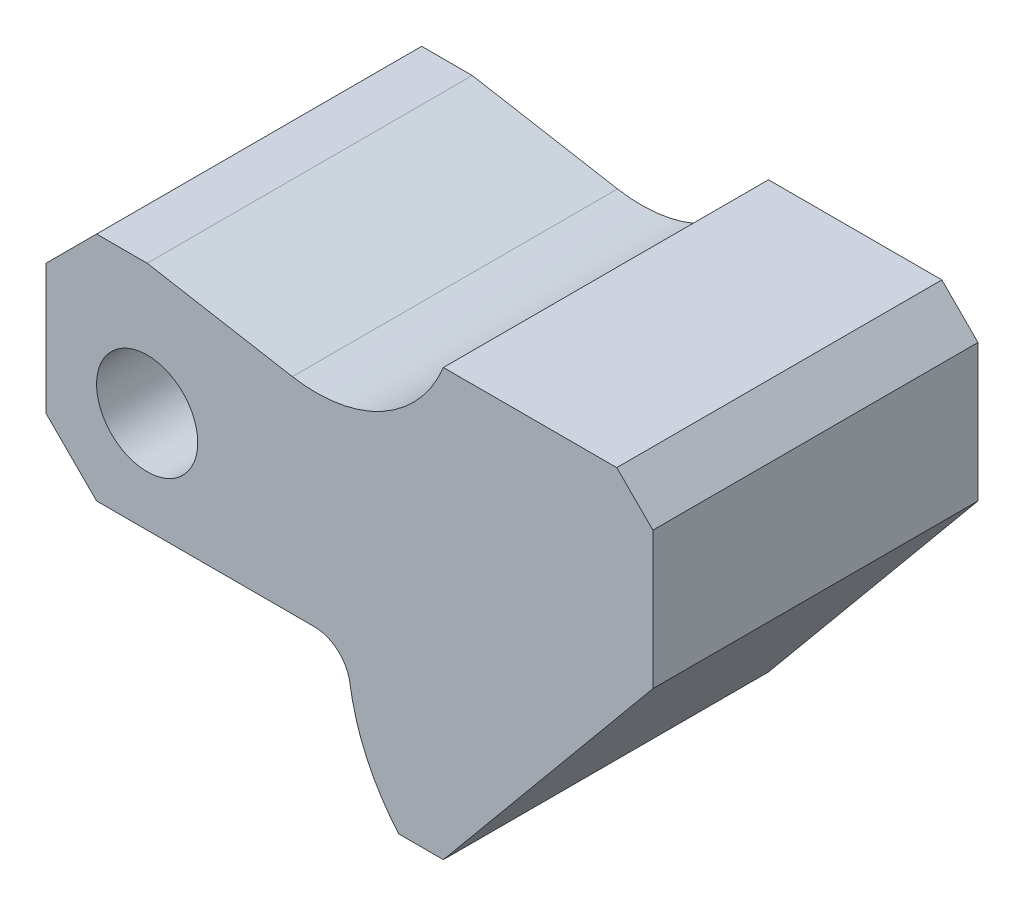
from build123d import *

# Parameters (mm, degrees)
BOSS_EXTRU_1_DEPTH      = 22.5
ESQUISSE2_R             = 7
ENL_V_MAT_EXTRU_1_DEPTH = 89.82992258


with BuildPart() as part:
    # Esquisse1 → Boss.-Extru.1 (new, symmetric)
    with BuildSketch(Plane.XY):
        with BuildLine():
            Line((0, 0), (6.166045157, 0))
            Line((6.166045157, 0), (35.166045157, 35))
            Line((35.166045157, 35), (35.166045157, 54))
            Line((35.166045157, 54), (30.166045157, 59))
            Line((30.166045157, 59), (6.166045157, 59))
            ThreePointArc((6.166045157, 59), (-2.242317514, 49.535902458), (-14.729912491, 47.455114912))
            Line((-14.729912491, 47.455114912), (-34.833954843, 51))
            Line((-34.833954843, 51), (-41.833954843, 51))
            Line((-41.833954843, 51), (-48.833954843, 44))
            Line((-48.833954843, 44), (-48.833954843, 26))
            Line((-48.833954843, 26), (-41.833954843, 19))
            Line((-41.833954843, 19), (-11.721441141, 19))
            ThreePointArc((-11.721441141, 19), (-8.45620536, 17.786586232), (-6.7758024, 14.735294118))
            ThreePointArc((-6.7758024, 14.735294118), (-4.438972197, 6.884327939), (0, 0))
        make_face()
    extrude(amount=BOSS_EXTRU_1_DEPTH, both=True)

    # Esquisse2 → Enlèv. mat.-Extru.1 (cut, through all)
    with BuildSketch(Plane.XY.offset(22.5)):
        with Locations((-34.833954843, 33)):
            Circle(ESQUISSE2_R)
    extrude(amount=-ENL_V_MAT_EXTRU_1_DEPTH, mode=Mode.SUBTRACT)


solid = part.part
